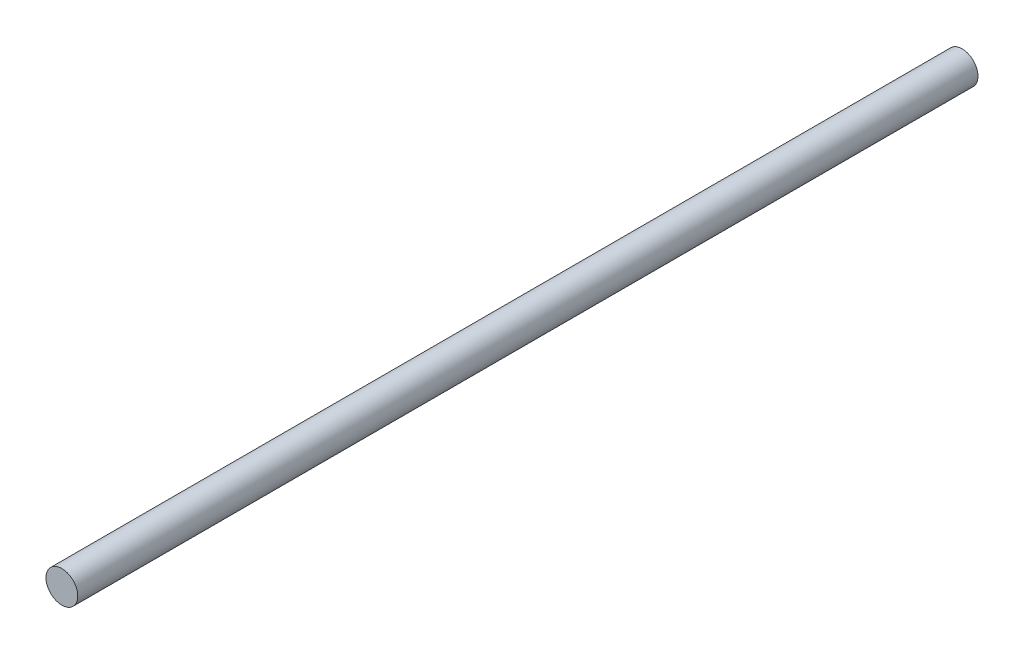
from build123d import *

# Parameters (mm, degrees)
SKETCH1_R           = 6
BOSS_EXTRUDE1_DEPTH = 340


with BuildPart() as part:
    # Sketch1 → Boss-Extrude1 (new body)
    with BuildSketch(Plane.XY):
        Circle(SKETCH1_R)
    extrude(amount=BOSS_EXTRUDE1_DEPTH)


solid = part.part
